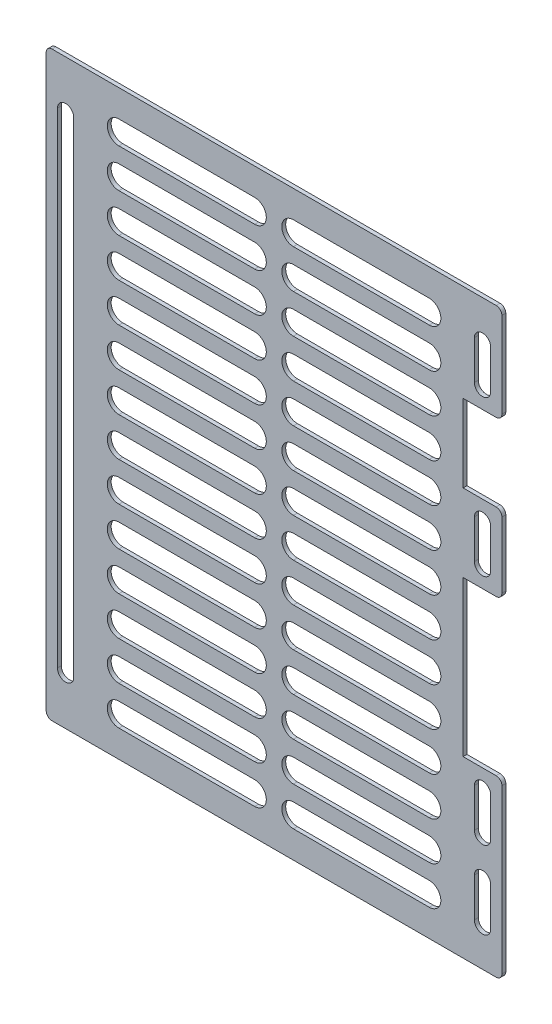
from build123d import *

# Parameters (mm, degrees)
SKETCH_1_W          = 235
SKETCH_1_H          = 300
EXTRUDE_1_DEPTH     = 2
CUT_EXTRUDE_1_DEPTH = 191.552486208
SKETCH_5_W          = 20
SKETCH_5_H          = 80
SKETCH_5_H_2        = 40
CUT_EXTRUDE_2_DEPTH = 191.552486208
FILLET_1_R          = 3


with BuildPart() as part:
    # 草图1 → 凸台-拉伸1 (new body)
    with BuildSketch(Plane.XY):
        Rectangle(SKETCH_1_W, SKETCH_1_H)
    extrude(amount=EXTRUDE_1_DEPTH)

    # 草图4 → 切除-拉伸1 (cut, through all)
    with BuildSketch(Plane.XY.offset(2)):
        with BuildLine():
            Line((-103.3, 125), (-103.3, -125))
            ThreePointArc((-103.3, -125), (-107.5, -129.2), (-111.7, -125))
            Line((-111.7, -125), (-111.7, 125))
            ThreePointArc((-111.7, 125), (-107.5, 129.2), (-103.3, 125))
        make_face()
        with BuildLine():
            Line((111.7, 130), (111.7, 110))
            ThreePointArc((111.7, 110), (107.5, 105.8), (103.3, 110))
            Line((103.3, 110), (103.3, 130))
            ThreePointArc((103.3, 130), (107.5, 134.2), (111.7, 130))
        make_face()
        with BuildLine():
            Line((103.3, 90), (103.3, 70))
            ThreePointArc((103.3, 70), (107.5, 65.8), (111.7, 70))
            Line((111.7, 70), (111.7, 90))
            ThreePointArc((111.7, 90), (107.5, 94.2), (103.3, 90))
        make_face()
        with BuildLine():
            Line((103.3, 50), (103.3, 30))
            ThreePointArc((103.3, 30), (107.5, 25.8), (111.7, 30))
            Line((111.7, 30), (111.7, 50))
            ThreePointArc((111.7, 50), (107.5, 54.2), (103.3, 50))
        make_face()
        with BuildLine():
            Line((103.3, 10), (103.3, -10))
            ThreePointArc((103.3, -10), (107.5, -14.2), (111.7, -10))
            Line((111.7, -10), (111.7, 10))
            ThreePointArc((111.7, 10), (107.5, 14.2), (103.3, 10))
        make_face()
        with BuildLine():
            Line((103.3, -30), (103.3, -50))
            ThreePointArc((103.3, -50), (107.5, -54.2), (111.7, -50))
            Line((111.7, -50), (111.7, -30))
            ThreePointArc((111.7, -30), (107.5, -25.8), (103.3, -30))
        make_face()
        with BuildLine():
            Line((103.3, -70), (103.3, -90))
            ThreePointArc((103.3, -90), (107.5, -94.2), (111.7, -90))
            Line((111.7, -90), (111.7, -70))
            ThreePointArc((111.7, -70), (107.5, -65.8), (103.3, -70))
        make_face()
        with BuildLine():
            Line((103.3, -110), (103.3, -130))
            ThreePointArc((103.3, -130), (107.5, -134.2), (111.7, -130))
            Line((111.7, -130), (111.7, -110))
            ThreePointArc((111.7, -110), (107.5, -105.8), (103.3, -110))
        make_face()
        with BuildLine():
            Line((-80, 136), (-10, 136))
            ThreePointArc((-10, 136), (-4, 130), (-10, 124))
            Line((-10, 124), (-80, 124))
            ThreePointArc((-80, 124), (-86, 130), (-80, 136))
        make_face()
        with BuildLine():
            Line((-80, 104), (-10, 104))
            ThreePointArc((-10, 104), (-4, 110), (-10, 116))
            Line((-10, 116), (-80, 116))
            ThreePointArc((-80, 116), (-86, 110), (-80, 104))
        make_face()
        with BuildLine():
            Line((-80, 84), (-10, 84))
            ThreePointArc((-10, 84), (-4, 90), (-10, 96))
            Line((-10, 96), (-80, 96))
            ThreePointArc((-80, 96), (-86, 90), (-80, 84))
        make_face()
        with BuildLine():
            Line((-80, 64), (-10, 64))
            ThreePointArc((-10, 64), (-4, 70), (-10, 76))
            Line((-10, 76), (-80, 76))
            ThreePointArc((-80, 76), (-86, 70), (-80, 64))
        make_face()
        with BuildLine():
            Line((-80, 44), (-10, 44))
            ThreePointArc((-10, 44), (-4, 50), (-10, 56))
            Line((-10, 56), (-80, 56))
            ThreePointArc((-80, 56), (-86, 50), (-80, 44))
        make_face()
        with BuildLine():
            Line((-80, 24), (-10, 24))
            ThreePointArc((-10, 24), (-4, 30), (-10, 36))
            Line((-10, 36), (-80, 36))
            ThreePointArc((-80, 36), (-86, 30), (-80, 24))
        make_face()
        with BuildLine():
            Line((-80, 4), (-10, 4))
            ThreePointArc((-10, 4), (-4, 10), (-10, 16))
            Line((-10, 16), (-80, 16))
            ThreePointArc((-80, 16), (-86, 10), (-80, 4))
        make_face()
        with BuildLine():
            Line((-80, -16), (-10, -16))
            ThreePointArc((-10, -16), (-4, -10), (-10, -4))
            Line((-10, -4), (-80, -4))
            ThreePointArc((-80, -4), (-86, -10), (-80, -16))
        make_face()
        with BuildLine():
            Line((-80, -36), (-10, -36))
            ThreePointArc((-10, -36), (-4, -30), (-10, -24))
            Line((-10, -24), (-80, -24))
            ThreePointArc((-80, -24), (-86, -30), (-80, -36))
        make_face()
        with BuildLine():
            Line((-80, -56), (-10, -56))
            ThreePointArc((-10, -56), (-4, -50), (-10, -44))
            Line((-10, -44), (-80, -44))
            ThreePointArc((-80, -44), (-86, -50), (-80, -56))
        make_face()
        with BuildLine():
            Line((-80, -76), (-10, -76))
            ThreePointArc((-10, -76), (-4, -70), (-10, -64))
            Line((-10, -64), (-80, -64))
            ThreePointArc((-80, -64), (-86, -70), (-80, -76))
        make_face()
        with BuildLine():
            Line((-80, -96), (-10, -96))
            ThreePointArc((-10, -96), (-4, -90), (-10, -84))
            Line((-10, -84), (-80, -84))
            ThreePointArc((-80, -84), (-86, -90), (-80, -96))
        make_face()
        with BuildLine():
            Line((-80, -116), (-10, -116))
            ThreePointArc((-10, -116), (-4, -110), (-10, -104))
            Line((-10, -104), (-80, -104))
            ThreePointArc((-80, -104), (-86, -110), (-80, -116))
        make_face()
        with BuildLine():
            Line((-80, -136), (-10, -136))
            ThreePointArc((-10, -136), (-4, -130), (-10, -124))
            Line((-10, -124), (-80, -124))
            ThreePointArc((-80, -124), (-86, -130), (-80, -136))
        make_face()
        with BuildLine():
            Line((80, -124), (10, -124))
            ThreePointArc((10, -124), (4, -130), (10, -136))
            Line((10, -136), (80, -136))
            ThreePointArc((80, -136), (86, -130), (80, -124))
        make_face()
        with BuildLine():
            Line((80, -104), (10, -104))
            ThreePointArc((10, -104), (4, -110), (10, -116))
            Line((10, -116), (80, -116))
            ThreePointArc((80, -116), (86, -110), (80, -104))
        make_face()
        with BuildLine():
            Line((80, -84), (10, -84))
            ThreePointArc((10, -84), (4, -90), (10, -96))
            Line((10, -96), (80, -96))
            ThreePointArc((80, -96), (86, -90), (80, -84))
        make_face()
        with BuildLine():
            Line((80, -64), (10, -64))
            ThreePointArc((10, -64), (4, -70), (10, -76))
            Line((10, -76), (80, -76))
            ThreePointArc((80, -76), (86, -70), (80, -64))
        make_face()
        with BuildLine():
            Line((80, -44), (10, -44))
            ThreePointArc((10, -44), (4, -50), (10, -56))
            Line((10, -56), (80, -56))
            ThreePointArc((80, -56), (86, -50), (80, -44))
        make_face()
        with BuildLine():
            Line((80, -24), (10, -24))
            ThreePointArc((10, -24), (4, -30), (10, -36))
            Line((10, -36), (80, -36))
            ThreePointArc((80, -36), (86, -30), (80, -24))
        make_face()
        with BuildLine():
            Line((80, -4), (10, -4))
            ThreePointArc((10, -4), (4, -10), (10, -16))
            Line((10, -16), (80, -16))
            ThreePointArc((80, -16), (86, -10), (80, -4))
        make_face()
        with BuildLine():
            Line((80, 36), (10, 36))
            ThreePointArc((10, 36), (4, 30), (10, 24))
            Line((10, 24), (80, 24))
            ThreePointArc((80, 24), (86, 30), (80, 36))
        make_face()
        with BuildLine():
            Line((80, 16), (10, 16))
            ThreePointArc((10, 16), (4, 10), (10, 4))
            Line((10, 4), (80, 4))
            ThreePointArc((80, 4), (86, 10), (80, 16))
        make_face()
        with BuildLine():
            Line((80, 56), (10, 56))
            ThreePointArc((10, 56), (4, 50), (10, 44))
            Line((10, 44), (80, 44))
            ThreePointArc((80, 44), (86, 50), (80, 56))
        make_face()
        with BuildLine():
            Line((80, 76), (10, 76))
            ThreePointArc((10, 76), (4, 70), (10, 64))
            Line((10, 64), (80, 64))
            ThreePointArc((80, 64), (86, 70), (80, 76))
        make_face()
        with BuildLine():
            Line((80, 96), (10, 96))
            ThreePointArc((10, 96), (4, 90), (10, 84))
            Line((10, 84), (80, 84))
            ThreePointArc((80, 84), (86, 90), (80, 96))
        make_face()
        with BuildLine():
            Line((80, 116), (10, 116))
            ThreePointArc((10, 116), (4, 110), (10, 104))
            Line((10, 104), (80, 104))
            ThreePointArc((80, 104), (86, 110), (80, 116))
        make_face()
        with BuildLine():
            Line((80, 136), (10, 136))
            ThreePointArc((10, 136), (4, 130), (10, 124))
            Line((10, 124), (80, 124))
            ThreePointArc((80, 124), (86, 130), (80, 136))
        make_face()
    extrude(amount=-CUT_EXTRUDE_1_DEPTH, mode=Mode.SUBTRACT)

    # 草图5 → 切除-拉伸2 (cut, through all)
    with BuildSketch(Plane.XY.offset(2)):
        with Locations((107.5, -20)):
            Rectangle(SKETCH_5_W, SKETCH_5_H)
        with Locations((107.5, 80)):
            Rectangle(SKETCH_5_W, SKETCH_5_H_2)
    extrude(amount=-CUT_EXTRUDE_2_DEPTH, mode=Mode.SUBTRACT)

    # 圆角1
    fillet_1_edges = [part.edges().sort_by_distance(p)[0] for p in [
        (117.5, 20, 1),
        (117.5, -60, 1),
        (117.5, 100, 1),
        (117.5, 60, 1),
        (117.5, -150, 1),
        (-117.5, -150, 1),
        (-117.5, 150, 1),
        (117.5, 150, 1),
    ]]
    fillet(fillet_1_edges, radius=FILLET_1_R)


solid = part.part
